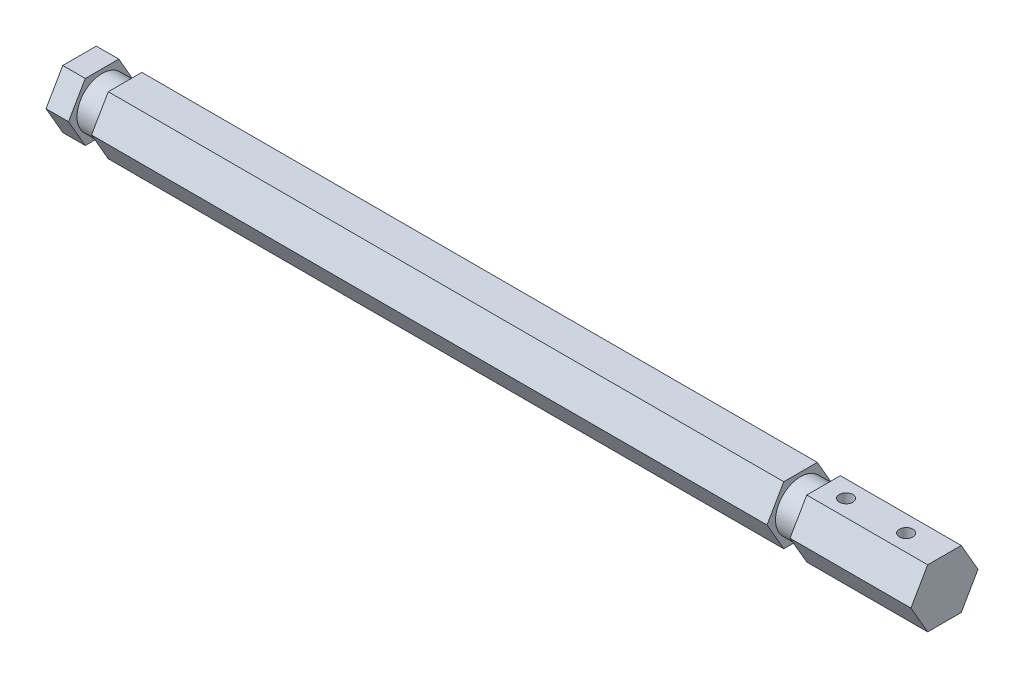
from build123d import *

# Parameters (mm, degrees)
BOSS_EXTRUDE1_DEPTH = 96.03
SKETCH2_W           = 5.1054
SKETCH2_H           = 5.89375
SKETCH3_R           = 1.5
CUT_EXTRUDE1_DEPTH  = 98.178397291


with BuildPart() as part:
    # Sketch1 → Boss-Extrude1 (new, symmetric)
    with BuildSketch(Plane(origin=(0, 0, 0), x_dir=(0, 0, -1), z_dir=(1, 0, 0))):
        Polygon((7.447818473, 0), (3.723909236, 6.45), (-3.723909236, 6.45), (-7.447818473, 0), (-3.723909236, -6.45), (3.723909236, -6.45), align=None)
    extrude(amount=BOSS_EXTRUDE1_DEPTH, both=True)

    # Sketch2 → Cut-Revolve1 (revolve, cut)
    with BuildSketch(Plane.XY, mode=Mode.PRIVATE) as cut_revolve1_sk:
        with Locations((-88.4773, 8.503125)):
            Rectangle(SKETCH2_W, SKETCH2_H)
        with Locations((66.6281, 8.503125)):
            Rectangle(SKETCH2_W, SKETCH2_H)
    revolve(cut_revolve1_sk.sketch.rotate(Axis((-251.263286978, 0, 0), (1, 0, 0)), 90), axis=Axis((-251.263286978, 0, 0), (1, 0, 0)), mode=Mode.SUBTRACT)

    # Sketch3 → Cut-Extrude1 (cut, through all)
    with BuildSketch(Plane(origin=(0, 6.45, 0), x_dir=(1, 0, 0), z_dir=(0, 1, 0))):
        with Locations(Location((74.1808, 0, 0), (0, 0, 270))):
            Circle(SKETCH3_R)
        with Locations(Location((87.5308, 0, 0), (0, 0, 270))):
            Circle(SKETCH3_R)
    extrude(amount=-CUT_EXTRUDE1_DEPTH, mode=Mode.SUBTRACT)


solid = part.part
